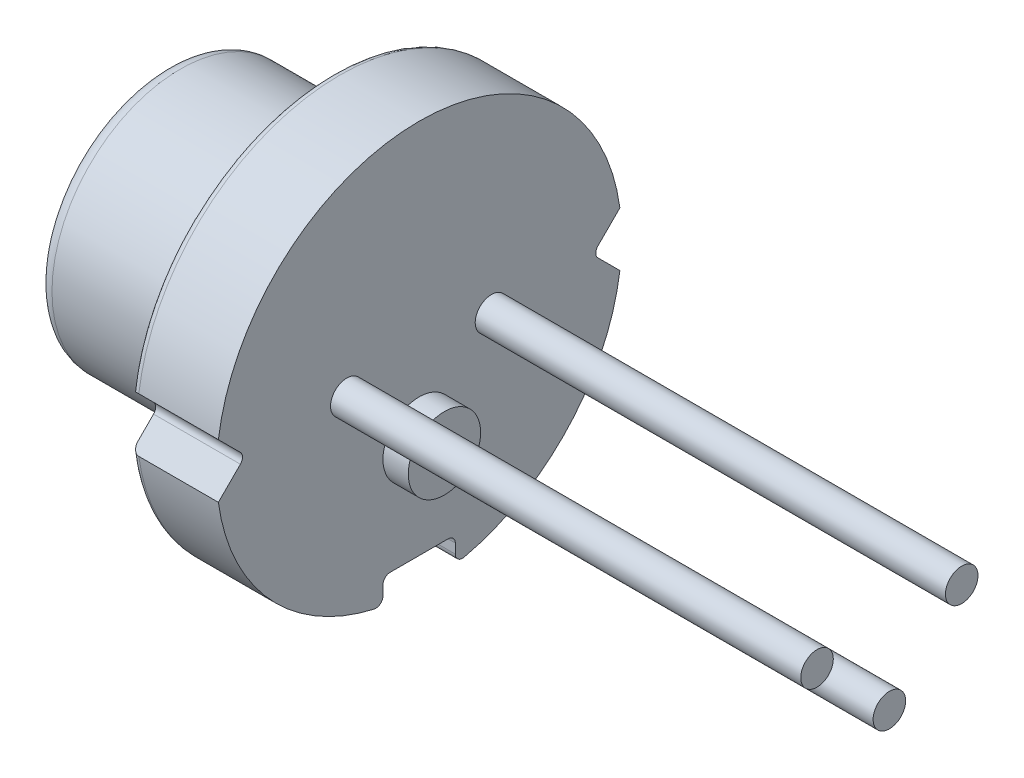
from build123d import *

# Parameters (mm, degrees)
SKETCH6_R           = 0.225
EXTRUDE2_DEPTH      = 6.5
CUT_EXTRUDE1_DEPTH  = 8.611175993
BOSS_EXTRUDE1_START = 0.25
SKETCH10_R          = 0.8
BOSS_EXTRUDE1_DEPTH = 0.25
FILLET1_R           = 0.2
FILLET2_R           = 0.1
SKETCH6_3_R         = 0.5
SKETCH6_3_R_2       = 0.225
BOSS_EXTRUDE2_DEPTH = 0.35
FILLET4_R           = 0.1
FILLET5_R           = 0.1
FILLET6_R           = 0.1
FILLET7_R           = 0.1
FILLET8_R           = 0.1


with BuildPart() as part:
    # Sketch4 → Revolve2 (revolve)
    with BuildSketch(Plane.XY):
        with BuildLine():
            Line((0, 0), (0, 0.7))
            Line((0, 0.7), (-0.65, 0.7))
            Line((-0.65, 0.7), (-0.65, 0.8))
            Line((-0.65, 0.8), (-0.95, 0.8))
            Line((-0.95, 0.8), (-0.95, 1.775))
            Line((-0.95, 1.775), (0.8, 1.775))
            ThreePointArc((0.8, 1.775), (0.976776695, 1.848223305), (1.05, 2.025))
            Line((1.05, 2.025), (1.05, 2.1))
            Line((1.05, 2.1), (1.35, 2.1))
            Line((1.35, 2.1), (1.35, 2.8))
            Line((1.35, 2.8), (2.55, 2.8))
            Line((2.55, 2.8), (2.55, 0))
            Line((2.55, 0), (0, 0))
        make_face()
    revolve(axis=Axis((-2.49171246, 0, 0), (1, 0, 0)))

    # Sketch6 → Extrude2 (add)
    with BuildSketch(Plane(origin=(2.55, 0, 0), x_dir=(0, 0, -1), z_dir=(1, 0, 0))):
        with Locations((1, 0)):
            Circle(SKETCH6_R)
        with Locations((0, -1)):
            Circle(SKETCH6_R)
        with Locations((-1, 0)):
            Circle(SKETCH6_R)
    extrude(amount=EXTRUDE2_DEPTH)

    # Sketch8 → Cut-Extrude1 (cut, through all)
    with BuildSketch(Plane(origin=(2.55, 0, 0), x_dir=(0, 0, -1), z_dir=(1, 0, 0))):
        with BuildLine():
            Line((2.774801575, 0.374801575), (2.4, 0))
            Line((2.4, 0), (2.774801575, -0.374801575))
            ThreePointArc((2.774801575, -0.374801575), (2.8, 0), (2.774801575, 0.374801575))
        make_face()
        with BuildLine():
            Line((-2.4, 0), (-2.774801575, 0.374801575))
            ThreePointArc((-2.774801575, 0.374801575), (-2.8, 0), (-2.774801575, -0.374801575))
            Line((-2.774801575, -0.374801575), (-2.4, 0))
        make_face()
        with BuildLine():
            ThreePointArc((-0.5, -2.754995463), (0, -2.8), (0.5, -2.754995463))
            Line((0.5, -2.754995463), (0.5, -2.4))
            Line((0.5, -2.4), (-0.5, -2.4))
            Line((-0.5, -2.4), (-0.5, -2.754995463))
        make_face()
    extrude(amount=-CUT_EXTRUDE1_DEPTH, mode=Mode.SUBTRACT)

    # Sketch10 → Boss-Extrude1 (add)
    with BuildSketch(Plane.ZY.offset(0.65).offset(BOSS_EXTRUDE1_START)):
        Circle(SKETCH10_R)
    extrude(amount=-BOSS_EXTRUDE1_DEPTH)

    # Fillet1
    fillet1_edges = [part.edges().sort_by_distance(p)[0] for p in [
        (-0.95, -1.775, 0),
    ]]
    fillet(fillet1_edges, radius=FILLET1_R)

    # Fillet2
    fillet2_edges = [part.edges().sort_by_distance(p)[0] for p in [
        (1.35, -1.934576937, -2.02420653),
        (1.35, -1.934576937, 2.02420653),
        (1.35, 2.8, 0),
    ]]
    fillet(fillet2_edges, radius=FILLET2_R)

    # Sketch6<3> → Boss-Extrude2 (add)
    with BuildSketch(Plane(origin=(2.55, 0, 0), x_dir=(0, 0, -1), z_dir=(1, 0, 0))):
        with Locations((0, -1)):
            Circle(SKETCH6_3_R)
        with Locations((0, -1)):
            Circle(SKETCH6_3_R_2, mode=Mode.SUBTRACT)
    extrude(amount=BOSS_EXTRUDE2_DEPTH)

    # Fillet4
    fillet4_edges = [part.edges().sort_by_distance(p)[0] for p in [
        (1.95, -2.4, 0.5),
    ]]
    fillet(fillet4_edges, radius=FILLET4_R)

    # Fillet5
    fillet5_edges = [part.edges().sort_by_distance(p)[0] for p in [
        (1.95, -2.4, -0.5),
    ]]
    fillet(fillet5_edges, radius=FILLET5_R)

    # Fillet6
    fillet6_edges = [part.edges().sort_by_distance(p)[0] for p in [
        (2, -2.754995463, -0.5),
        (1.378931181, -2.724856522, -0.5),
        (1.35, -2.576649916, -0.5),
        (1.35, -2.429289322, -0.470710678),
        (1.35, -2.4, 0),
        (1.35, -2.429289322, 0.470710678),
        (1.35, -2.576649916, 0.5),
        (1.378985991, -2.724912772, 0.5),
        (2, -2.754995463, 0.5),
    ]]
    fillet(fillet6_edges, radius=FILLET6_R)

    # Fillet7
    fillet7_edges = [part.edges().sort_by_distance(p)[0] for p in [
        (1.95, 0, 2.4),
    ]]
    fillet(fillet7_edges, radius=FILLET7_R)

    # Fillet8
    fillet8_edges = [part.edges().sort_by_distance(p)[0] for p in [
        (1.95, 0, -2.4),
    ]]
    fillet(fillet8_edges, radius=FILLET8_R)


solid = part.part
